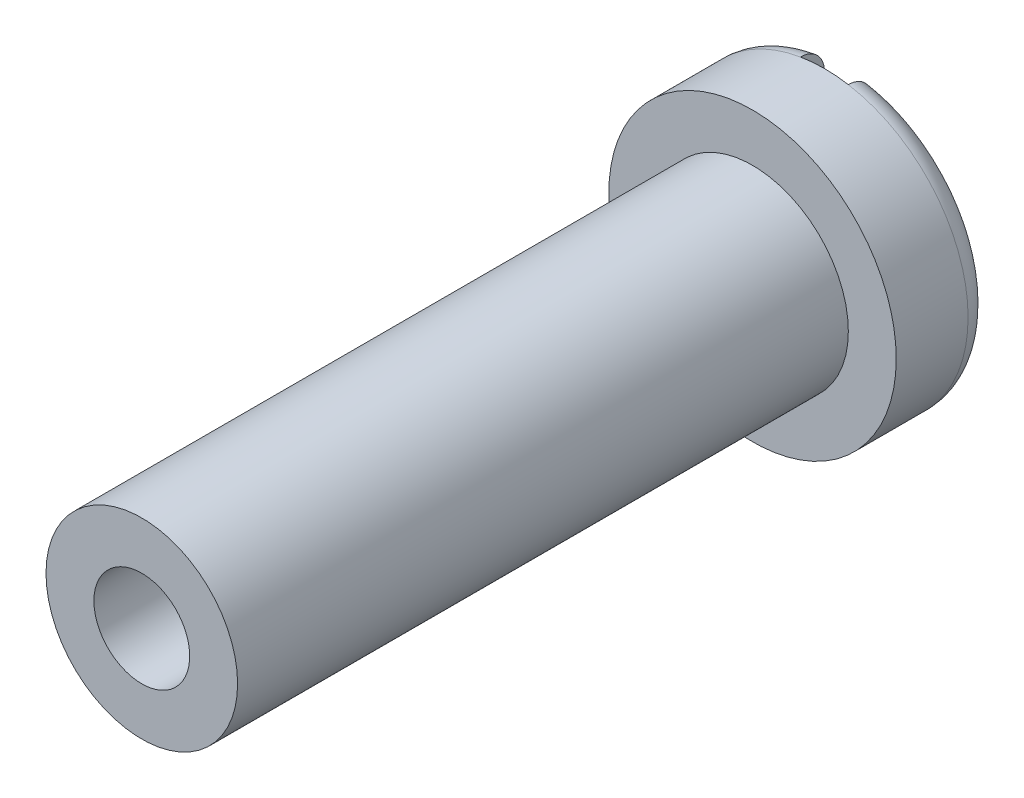
from build123d import *

# Parameters (mm, degrees)
SKETCH1_R               = 3
BOSS_EXTRUDE1_DEPTH     = 2
FILLET1_R               = 0.5
SKETCH2_R               = 2
BOSS_EXTRUDE2_DEPTH     = 12.75
CUT_EXTRUDE1_DEPTH      = 16.348045478
CUT_EXTRUDE1_DEPTH_BACK = 16.348045478
SKETCH3_R               = 1
SKETCH4_W               = 1
SKETCH4_H               = 6
CUT_EXTRUDE3_DEPTH      = 0.5


with BuildPart() as part:
    # Sketch1 → Boss-Extrude1 (new body)
    with BuildSketch(Plane.XY):
        Circle(SKETCH1_R)
    extrude(amount=BOSS_EXTRUDE1_DEPTH)

    # Fillet1
    fillet1_edges = [part.edges().sort_by_distance(p)[0] for p in [
        (-3, 0, 0),
    ]]
    fillet(fillet1_edges, radius=FILLET1_R)

    # Sketch2 → Boss-Extrude2 (add)
    with BuildSketch(Plane.XY.offset(2)):
        Circle(SKETCH2_R)
    extrude(amount=BOSS_EXTRUDE2_DEPTH)

    # Sketch3 → Cut-Extrude1 (cut, two sides: drawn at the far end of the back side and taken through both)
    with BuildSketch(Plane(origin=(0, 0, 0), x_dir=(-1, 0, 0), z_dir=(0, 0, -1)).offset(-CUT_EXTRUDE1_DEPTH_BACK)):
        Circle(SKETCH3_R)
    extrude(amount=CUT_EXTRUDE1_DEPTH + CUT_EXTRUDE1_DEPTH_BACK, mode=Mode.SUBTRACT)

    # Sketch4 → Cut-Extrude3 (cut)
    with BuildSketch(Plane(origin=(0, 0, 0), x_dir=(-1, 0, 0), z_dir=(0, 0, -1))):
        Rectangle(SKETCH4_W, SKETCH4_H)
    extrude(amount=-CUT_EXTRUDE3_DEPTH, mode=Mode.SUBTRACT)


solid = part.part
